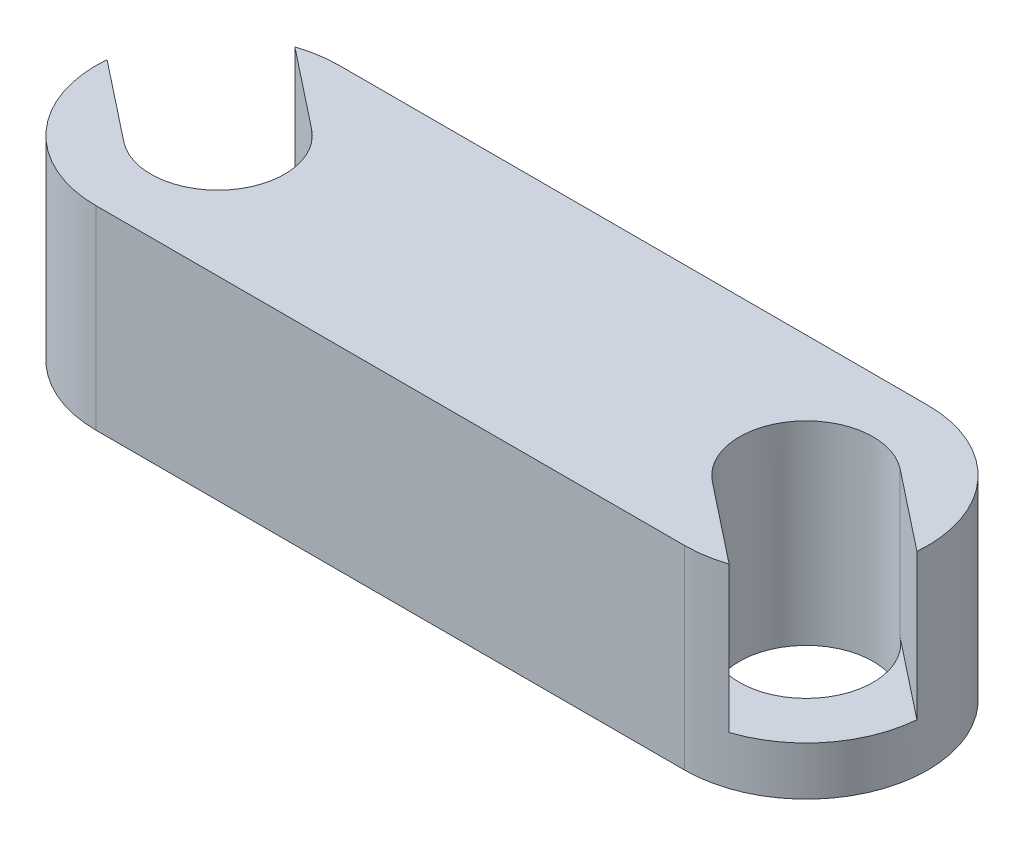
from build123d import *

# Parameters (mm, degrees)
SKETCH1_R           = 2.75
BOSS_EXTRUDE1_DEPTH = 8
CUT_EXTRUDE1_DEPTH  = 6


with BuildPart() as part:
    # Sketch1 → Boss-Extrude1 (new body)
    with BuildSketch(Plane(origin=(0, 0, 0), x_dir=(1, 0, 0), z_dir=(0, 1, 0))):
        with BuildLine():
            Line((-7.712527276, 6.5), (16.494909594, 6.5))
            ThreePointArc((16.494909594, 6.5), (21.494909594, 1.5), (16.494909594, -3.5))
            Line((16.494909594, -3.5), (-7.712527276, -3.5))
            ThreePointArc((-7.712527276, -3.5), (-12.712527276, 1.5), (-7.712527276, 6.5))
        make_face()
        with Locations(Location((-7.712527276, 1.5, 0), (0, 0, 270))):
            Circle(SKETCH1_R, mode=Mode.SUBTRACT)
        with Locations(Location((16.494909594, 1.5, 0), (0, 0, 270))):
            Circle(SKETCH1_R, mode=Mode.SUBTRACT)
    extrude(amount=BOSS_EXTRUDE1_DEPTH)

    # Sketch2 → Cut-Extrude1 (cut)
    with BuildSketch(Plane(origin=(0, 8, 0), x_dir=(1, 0, 0), z_dir=(0, 1, 0))):
        Polygon((18.198931387, 3.658427605), (14.7908878, -0.658427605), (24.721737917, -8.498572433), (28.129781504, -4.181717223), align=None)
        Polygon((-9.41654907, -0.658427605), (-6.008505483, 3.658427605), (-15.939355599, 11.498572433), (-19.347399186, 7.181717223), align=None)
    extrude(amount=-CUT_EXTRUDE1_DEPTH, mode=Mode.SUBTRACT)


solid = part.part
